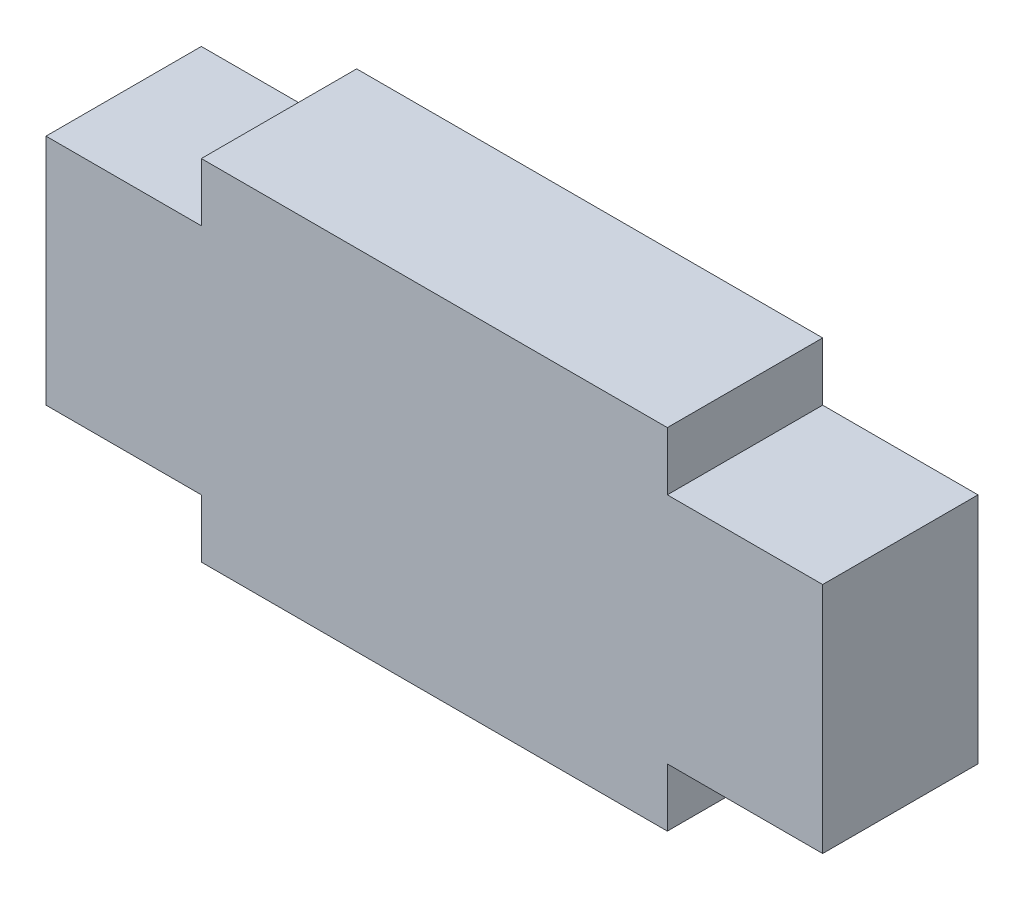
from build123d import *

# Parameters (mm, degrees)
EXTRUDE_1_DEPTH = 4


with BuildPart() as part:
    # Эскиз1 → Бобышка-Вытянуть1 (new body)
    with BuildSketch(Plane.XY):
        Polygon((0, 0), (0, 6), (4, 6), (4, 7.5), (16, 7.5), (16, 6), (20, 6), (20, 0), (16, 0), (16, -1.5), (4, -1.5), (4, 0), align=None)
    extrude(amount=EXTRUDE_1_DEPTH)


solid = part.part
